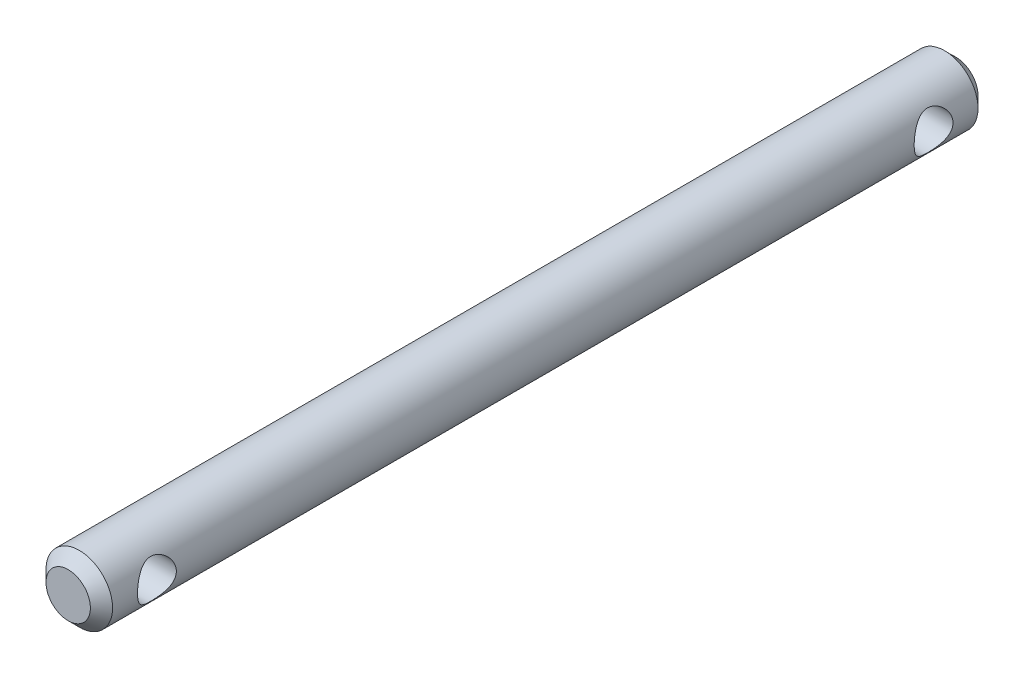
from build123d import *

# Parameters (mm, degrees)
SKETCH_1_R          = 3
EXTRUDE_1_DEPTH     = 5
SKETCH_2_R          = 3
EXTRUDE_2_DEPTH     = 75
SKETCH_3_R          = 1.75
CUT_EXTRUDE_1_DEPTH = 81.280757346
CHAMFER_1_SIZE      = 1


with BuildPart() as part:
    # Эскиз1 → Бобышка-Вытянуть1 (new body)
    with BuildSketch(Plane.XY):
        Circle(SKETCH_1_R)
    extrude(amount=EXTRUDE_1_DEPTH)

    # Эскиз2 → Бобышка-Вытянуть2 (add)
    with BuildSketch(Plane.XY.offset(5)):
        Circle(SKETCH_2_R)
    extrude(amount=EXTRUDE_2_DEPTH)

    # Эскиз3 → Вырез-Вытянуть1 (cut, through all)
    with BuildSketch(Plane(origin=(3, 0, 0), x_dir=(0, 0, -1), z_dir=(1, 0, 0))):
        with Locations((-75, 0)):
            Circle(SKETCH_3_R)
        with Locations((-5, 0)):
            Circle(SKETCH_3_R)
    extrude(amount=-CUT_EXTRUDE_1_DEPTH, mode=Mode.SUBTRACT)

    # Фаска1
    chamfer_1_edges = [part.edges().sort_by_distance(p)[0] for p in [
        (-3, 0, 0),
        (-3, 0, 80),
    ]]
    chamfer(chamfer_1_edges, length=CHAMFER_1_SIZE)


solid = part.part
